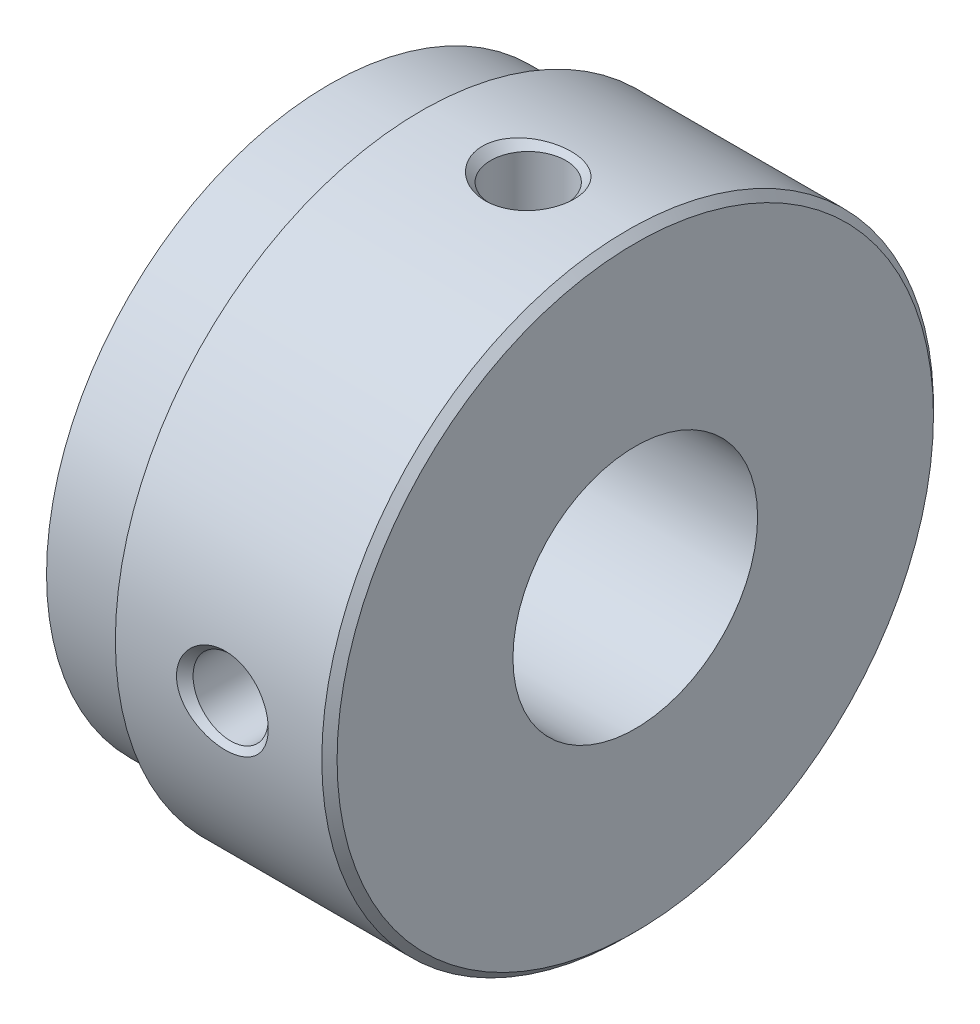
from build123d import *


with BuildPart() as part:
    # Sketch1 → Revolve1 (revolve)
    with BuildSketch(Plane.XY, mode=Mode.PRIVATE) as revolve1_sk:
        Polygon((0, 4), (10, 4), (10, 9.75), (9.75, 10), (3, 10), (3, 9.25), (0, 9.25), align=None)
    revolve(revolve1_sk.sketch.rotate(Axis((10, 0, 0), (-1, 0, 0)), 270), axis=Axis((10, 0, 0), (-1, 0, 0)))

    # Sketch2 → Cut-Revolve1 (revolve, cut)
    with BuildSketch(Plane(origin=(6.5, 0, 0), x_dir=(0, 0, -1), z_dir=(1, 0, 0)), mode=Mode.PRIVATE) as cut_revolve1_sk:
        Polygon((0, 10), (1.5, 10), (1.2295, 9.7295), (1.2295, 0), (0, 0), align=None)
    revolve(cut_revolve1_sk.sketch.rotate(Axis((6.5, 0, 0), (0, 1, 0)), 180), axis=Axis((6.5, 0, 0), (0, 1, 0)), mode=Mode.SUBTRACT)

    # Sketch3 → Cut-Revolve2 (revolve, cut)
    with BuildSketch(Plane(origin=(6.5, 0, 0), x_dir=(0, 0, -1), z_dir=(1, 0, 0)), mode=Mode.PRIVATE) as cut_revolve2_sk:
        Polygon((-10, 0), (-10, 1.5), (-9.7295, 1.2295), (0, 1.2295), (0, 0), align=None)
    revolve(cut_revolve2_sk.sketch.rotate(Axis((6.5, 0, 0), (0, 0, 1)), 180), axis=Axis((6.5, 0, 0), (0, 0, 1)), mode=Mode.SUBTRACT)


solid = part.part
